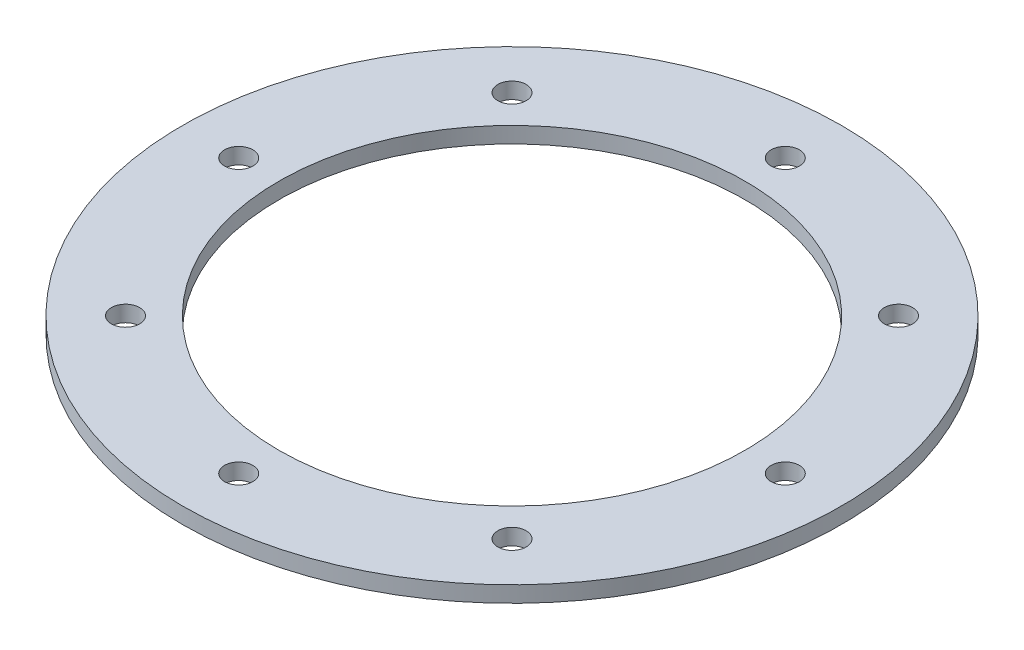
from build123d import *

# Parameters (mm, degrees)
SKETCH_1_R      = 102.5
SKETCH_1_R_2    = 72.5
SKETCH_1_R_3    = 4.4
EXTRUDE_1_DEPTH = 5


with BuildPart() as part:
    # Эскиз1 → Бобышка-Вытянуть1 (new body)
    with BuildSketch(Plane(origin=(0, 0, 0), x_dir=(1, 0, 0), z_dir=(0, 1, 0))):
        with Locations(Location((0, 0, 0), (0, 0, 270))):
            Circle(SKETCH_1_R)
        with Locations(Location((0, 0, 0), (0, 0, 270))):
            Circle(SKETCH_1_R_2, mode=Mode.SUBTRACT)
        with Locations(Location((85, 0, 0), (0, 0, 270))):
            Circle(SKETCH_1_R_3, mode=Mode.SUBTRACT)
        with Locations(Location((60.104076401, -60.104076401, 0), (0, 0, 270))):
            Circle(SKETCH_1_R_3, mode=Mode.SUBTRACT)
        with Locations(Location((0, -85, 0), (0, 0, 270))):
            Circle(SKETCH_1_R_3, mode=Mode.SUBTRACT)
        with Locations(Location((-60.104076401, -60.104076401, 0), (0, 0, 270))):
            Circle(SKETCH_1_R_3, mode=Mode.SUBTRACT)
        with Locations(Location((-85, 0, 0), (0, 0, 270))):
            Circle(SKETCH_1_R_3, mode=Mode.SUBTRACT)
        with Locations(Location((-60.104076401, 60.104076401, 0), (0, 0, 270))):
            Circle(SKETCH_1_R_3, mode=Mode.SUBTRACT)
        with Locations(Location((0, 85, 0), (0, 0, 270))):
            Circle(SKETCH_1_R_3, mode=Mode.SUBTRACT)
        with Locations(Location((60.104076401, 60.104076401, 0), (0, 0, 270))):
            Circle(SKETCH_1_R_3, mode=Mode.SUBTRACT)
    extrude(amount=EXTRUDE_1_DEPTH)


solid = part.part
